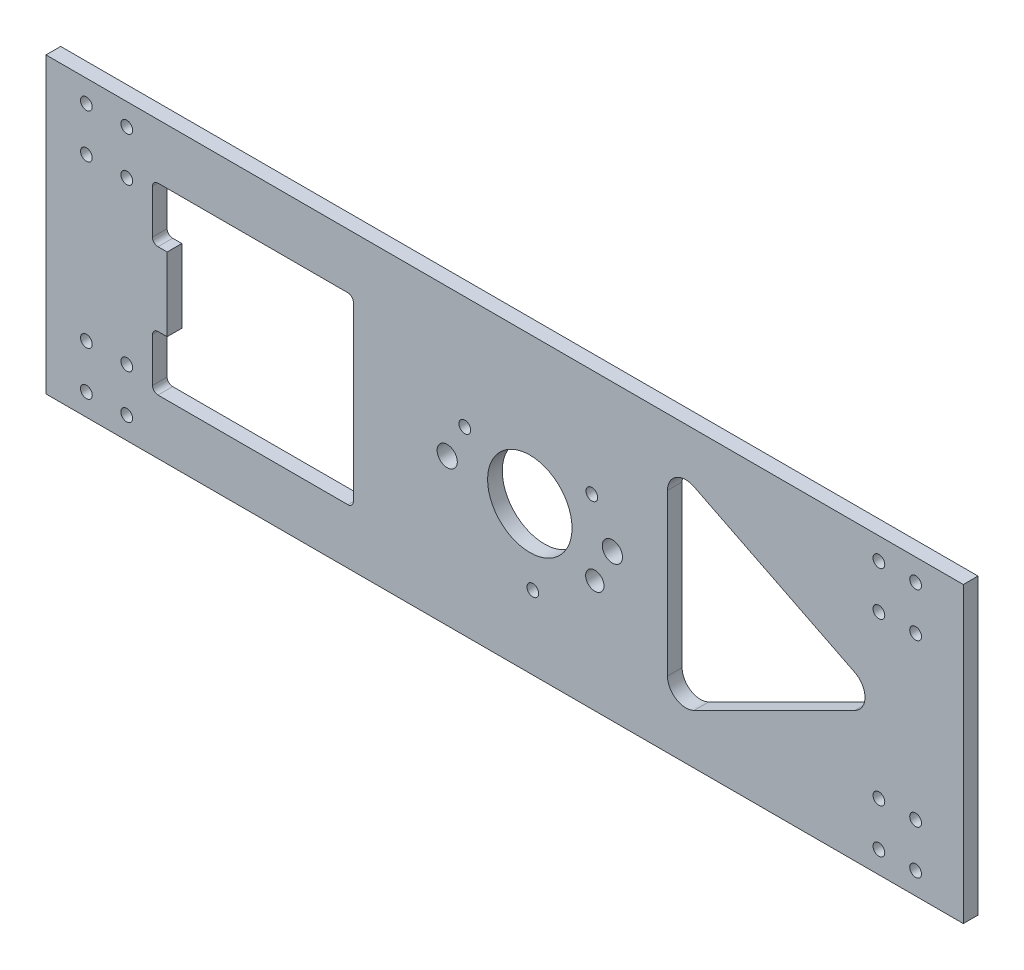
from build123d import *

# Parameters (mm, degrees)
SKETCH_1_W          = 249.901599808
SKETCH_1_H          = 80
EXTRUDE_1_DEPTH     = 4
SKETCH_2_R          = 2.75
SKETCH_2_R_2        = 2.55
CUT_EXTRUDE_1_DEPTH = 4
CUT_EXTRUDE_2_DEPTH = 10
SKETCH_4_R          = 1.6
CUT_EXTRUDE_3_DEPTH = 5
CUT_EXTRUDE_4_DEPTH = 10
FILLET_1_R          = 1.5
SKETCH_6_R          = 1.6
SKETCH_6_R_2        = 2.5
SKETCH_6_R_3        = 11.5
CUT_EXTRUDE_5_DEPTH = 5


with BuildPart() as part:
    # 草图1 → 凸台-拉伸1 (new body)
    with BuildSketch(Plane.XY):
        with Locations((36.107693766, 46.720773392)):
            Rectangle(SKETCH_1_W, SKETCH_1_H)
    extrude(amount=EXTRUDE_1_DEPTH)

    # 草图2 → 切除-拉伸1 (cut)
    with BuildSketch(Plane.XY.offset(4)):
        with Locations((20.45849367, 46.720773392)):
            Circle(SKETCH_2_R)
        with Locations((65.45849367, 46.720773392)):
            Circle(SKETCH_2_R)
        with Locations((42.95849367, 46.720773392)):
            Circle(SKETCH_2_R_2)
    extrude(amount=-CUT_EXTRUDE_1_DEPTH, mode=Mode.SUBTRACT)

    # 草图3 → 切除-拉伸2 (cut)
    with BuildSketch(Plane.XY.offset(4)):
        with BuildLine():
            Line((80.45849367, 68.630603448), (80.45849367, 24.810943336))
            ThreePointArc((80.45849367, 24.810943336), (82.829838109, 20.557689294), (87.694561647, 20.338807381))
            Line((87.694561647, 20.338807381), (131.51422176, 42.248637437))
            ThreePointArc((131.51422176, 42.248637437), (134.278153782, 46.720773392), (131.51422176, 51.192909347))
            Line((131.51422176, 51.192909347), (87.694561647, 73.102739403))
            ThreePointArc((87.694561647, 73.102739403), (82.829838109, 72.88385749), (80.45849367, 68.630603448))
        make_face()
    extrude(amount=-CUT_EXTRUDE_2_DEPTH, mode=Mode.SUBTRACT)

    # 草图4 → 切除-拉伸3 (cut)
    with BuildSketch(Plane.XY.offset(4)):
        with Locations((-77.843106138, 80.720773392)):
            Circle(SKETCH_4_R)
        with Locations((-77.843106138, 68.720773392)):
            Circle(SKETCH_4_R)
        with Locations((-66.843106138, 80.720773392)):
            Circle(SKETCH_4_R)
        with Locations((-66.843106138, 68.720773392)):
            Circle(SKETCH_4_R)
        with Locations((138.05849367, 80.720773392)):
            Circle(SKETCH_4_R)
        with Locations((138.05849367, 68.720773392)):
            Circle(SKETCH_4_R)
        with Locations((148.05849367, 80.720773392)):
            Circle(SKETCH_4_R)
        with Locations((148.05849367, 68.720773392)):
            Circle(SKETCH_4_R)
        with Locations((148.05849367, 24.720773392)):
            Circle(SKETCH_4_R)
        with Locations((148.05849367, 12.720773392)):
            Circle(SKETCH_4_R)
        with Locations((138.05849367, 24.720773392)):
            Circle(SKETCH_4_R)
        with Locations((138.05849367, 12.720773392)):
            Circle(SKETCH_4_R)
        with Locations((-66.843106138, 24.720773392)):
            Circle(SKETCH_4_R)
        with Locations((-66.843106138, 12.720773392)):
            Circle(SKETCH_4_R)
        with Locations((-77.843106138, 24.720773392)):
            Circle(SKETCH_4_R)
        with Locations((-77.843106138, 12.720773392)):
            Circle(SKETCH_4_R)
    extrude(amount=-CUT_EXTRUDE_3_DEPTH, mode=Mode.SUBTRACT)

    # 草图5 → 切除-拉伸4 (cut)
    with BuildSketch(Plane.XY.offset(4)):
        Polygon((-59.843106138, 71.720773392), (-5.115253875, 71.720773392), (-5.115253875, 21.720773392), (-59.843106138, 21.720773392), (-59.843106138, 36.720773392), (-55.843106138, 36.720773392), (-55.843106138, 56.720773392), (-59.843106138, 56.720773392), align=None)
    extrude(amount=-CUT_EXTRUDE_4_DEPTH, mode=Mode.SUBTRACT)

    # 圆角1
    fillet_1_edges = [part.edges().sort_by_distance(p)[0] for p in [
        (-59.843106138, 56.720773392, 2),
        (-59.843106138, 71.720773392, 2),
        (-5.115253875, 71.720773392, 2),
        (-5.115253875, 21.720773392, 2),
        (-59.843106138, 21.720773392, 2),
        (-59.843106138, 36.720773392, 2),
    ]]
    fillet(fillet_1_edges, radius=FILLET_1_R)

    # 草图6 → 切除-拉伸5 (cut)
    with BuildSketch(Plane(origin=(0, 0, 0), x_dir=(-1, 0, 0), z_dir=(0, 0, -1))):
        with Locations((-25.244914522, 56.006736658)):
            Circle(SKETCH_6_R)
        with Locations((-43.773403156, 26.737382225)):
            Circle(SKETCH_6_R)
        with Locations((-59.857163331, 57.418201293)):
            Circle(SKETCH_6_R)
        with Locations((-60.672072817, 37.434810126)):
            Circle(SKETCH_6_R_2)
        with Locations((-42.95849367, 46.720773392)):
            Circle(SKETCH_6_R_3)
    extrude(amount=-CUT_EXTRUDE_5_DEPTH, mode=Mode.SUBTRACT)


solid = part.part
